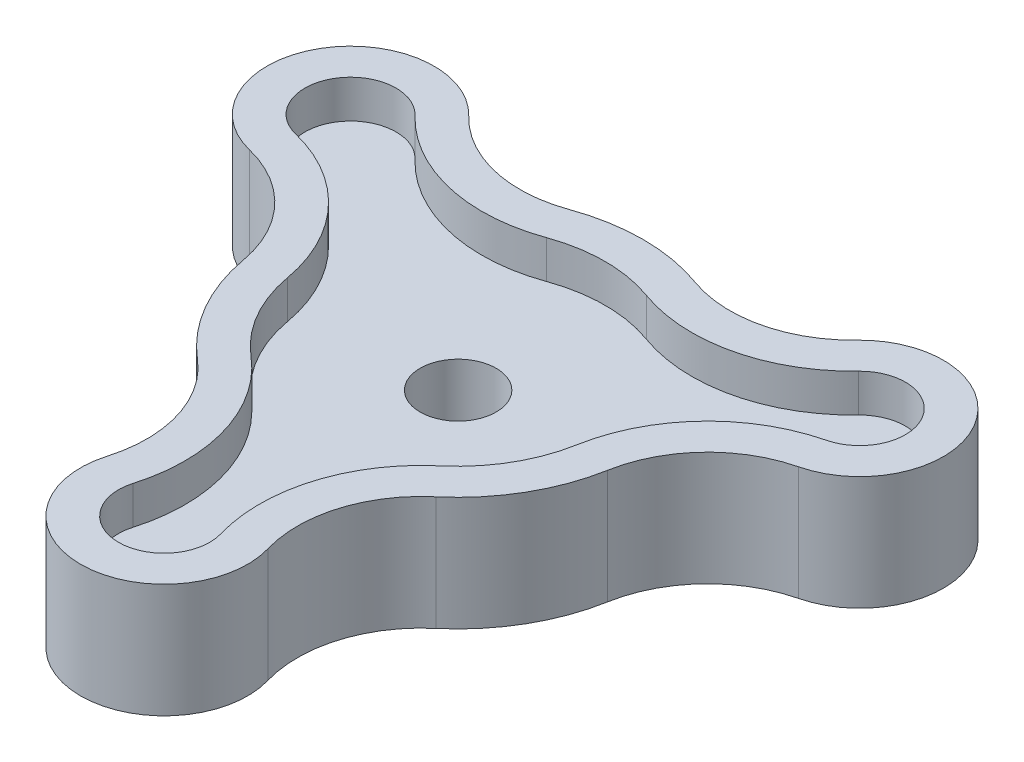
from build123d import *

# Parameters (mm, degrees)
SKETCH1_W           = 57.15
SKETCH1_H           = 57.15
BOSS_EXTRUDE1_DEPTH = 9.525
SKETCH5_R           = 12.281683601
SKETCH5_R_2         = 3.302
CUT_EXTRUDE1_DEPTH  = 3.175
SKETCH7_W           = 57.15
SKETCH7_H           = 57.15
CUT_EXTRUDE2_DEPTH  = 9.652
SKETCH10_R          = 3.175
CUT_EXTRUDE4_DEPTH  = 79.640756641


with BuildPart() as part:
    # Sketch1 → Boss-Extrude1 (new body)
    with BuildSketch(Plane(origin=(0, 0, 0), x_dir=(1, 0, 0), z_dir=(0, 1, 0))):
        with Locations((28.575, -28.575)):
            Rectangle(SKETCH1_W, SKETCH1_H)
    extrude(amount=BOSS_EXTRUDE1_DEPTH)

    # Sketch5 → Cut-Extrude1 (cut)
    # profile 1 of 5: a face of its own
    with BuildSketch(Plane(origin=(0, 9.525, 0), x_dir=(1, 0, 0), z_dir=(0, 1, 0))):
        with BuildLine():
            ThreePointArc((32.232759975, -45.931274041), (32.269707879, -38.244901062), (36.493054182, -31.822670864))
            ThreePointArc((36.493054182, -31.822670864), (28.575, -34.715841801), (20.656945818, -31.822670864))
            ThreePointArc((20.656945818, -31.822670864), (24.880292121, -38.244901062), (24.917240025, -45.931274041))
            ThreePointArc((24.917240025, -45.931274041), (28.575, -50.807525402), (32.232759975, -45.931274041))
        make_face()
    # profile 2 of 5: a face of its own
    with BuildSketch(Plane(origin=(0, 9.525, 0), x_dir=(1, 0, 0), z_dir=(0, 1, 0))):
        with Locations((28.575, -22.434158199)):
            Circle(SKETCH5_R)
        with Locations((28.575, -22.434158199)):
            Circle(SKETCH5_R_2, mode=Mode.SUBTRACT)
    # profile 3 of 5: a face of its own
    with BuildSketch(Plane(origin=(0, 9.525, 0), x_dir=(1, 0, 0), z_dir=(0, 1, 0))):
        with Locations((28.575, -22.434158199)):
            Circle(SKETCH5_R_2)
    # profile 4 of 5: a face of its own
    with BuildSketch(Plane(origin=(0, 9.525, 0), x_dir=(1, 0, 0), z_dir=(0, 1, 0))):
        with BuildLine():
            ThreePointArc((16.485282438, -24.597137937), (17.93875, -16.293316399), (24.403336619, -10.882665797))
            ThreePointArc((24.403336619, -10.882665797), (16.729848967, -11.329075886), (10.054780753, -7.517887219))
            ThreePointArc((10.054780753, -7.517887219), (4.002943212, -8.247474598), (6.397020778, -13.853313338))
            ThreePointArc((6.397020778, -13.853313338), (13.035141089, -17.72849765), (16.485282438, -24.597137937))
        make_face()
    # profile 5 of 5: a face of its own
    with BuildSketch(Plane(origin=(0, 9.525, 0), x_dir=(1, 0, 0), z_dir=(0, 1, 0))):
        with BuildLine():
            ThreePointArc((32.746663381, -10.882665797), (38.626736214, -15.377080109), (40.856683601, -22.434158199))
            ThreePointArc((40.856683601, -22.434158199), (40.808597958, -23.519898995), (40.664717562, -24.597137937))
            ThreePointArc((40.664717562, -24.597137937), (44.114858911, -17.72849765), (50.752979222, -13.853313338))
            ThreePointArc((50.752979222, -13.853313338), (53.147056788, -8.247474598), (47.095219247, -7.517887219))
            ThreePointArc((47.095219247, -7.517887219), (40.420151033, -11.329075886), (32.746663381, -10.882665797))
        make_face()
    extrude(amount=-CUT_EXTRUDE1_DEPTH, mode=Mode.SUBTRACT)

    # Sketch7 → Cut-Extrude2 (cut)
    with BuildSketch(Plane(origin=(0, 9.525, 0), x_dir=(1, 0, 0), z_dir=(0, 1, 0))):
        with Locations((28.575, -28.575)):
            Rectangle(SKETCH7_W, SKETCH7_H)
        with BuildLine():
            ThreePointArc((12.348348048, -5.322397737), (1.253312555, -6.659974598), (5.64245476, -16.937345621))
            ThreePointArc((5.64245476, -16.937345621), (10.720573118, -19.901836121), (13.359908547, -25.156300743))
            ThreePointArc((13.359908547, -25.156300743), (15.189119343, -30.1625), (18.610009678, -34.249742647))
            ThreePointArc((18.610009678, -34.249742647), (21.840841809, -39.162706489), (21.869106713, -45.042731239))
            ThreePointArc((21.869106713, -45.042731239), (28.575, -53.982525402), (35.280893287, -45.042731239))
            ThreePointArc((35.280893287, -45.042731239), (35.309158191, -39.162706489), (38.539990322, -34.249742647))
            ThreePointArc((38.539990322, -34.249742647), (41.960880657, -30.1625), (43.790091453, -25.156300743))
            ThreePointArc((43.790091453, -25.156300743), (46.429426882, -19.901836121), (51.50754524, -16.937345621))
            ThreePointArc((51.50754524, -16.937345621), (55.896687445, -6.659974598), (44.801651952, -5.322397737))
            ThreePointArc((44.801651952, -5.322397737), (39.695268692, -8.237931989), (33.825101131, -7.896431208))
            ThreePointArc((33.825101131, -7.896431208), (28.575, -6.977474598), (23.324898869, -7.896431208))
            ThreePointArc((23.324898869, -7.896431208), (17.454731308, -8.237931989), (12.348348048, -5.322397737))
        make_face(mode=Mode.SUBTRACT)
    extrude(amount=-CUT_EXTRUDE2_DEPTH, mode=Mode.SUBTRACT)

    # Sketch10 → Cut-Extrude4 (cut, through all)
    with BuildSketch(Plane(origin=(0, 6.35, 0), x_dir=(1, 0, 0), z_dir=(0, 1, 0))):
        with Locations(Location((28.575, -22.434158199, 0), (0, 0, 270))):
            Circle(SKETCH10_R)
    extrude(amount=-CUT_EXTRUDE4_DEPTH, mode=Mode.SUBTRACT)


solid = part.part
